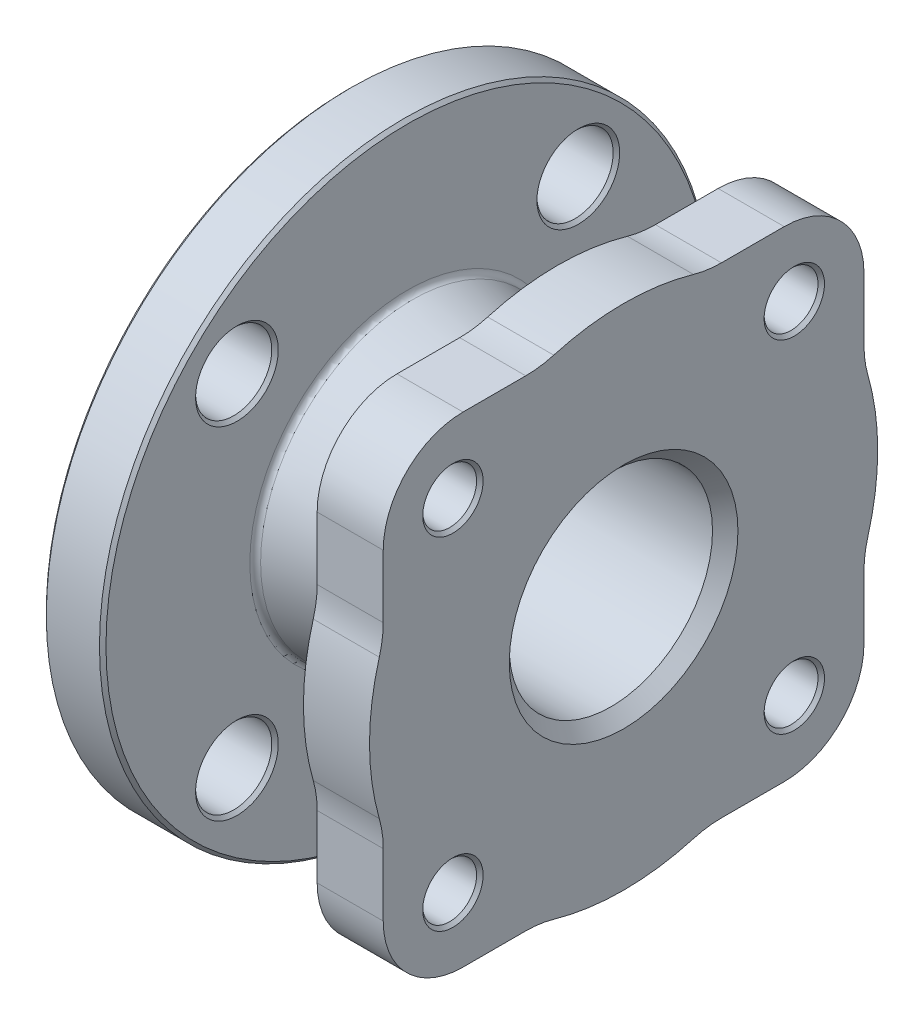
from build123d import *

# Parameters (mm, degrees)
SALIENTE_EXTRUIR1_START = 16.51
CROQUIS2_R              = 6.731
CROQUIS2_R_2            = 25.4
SALIENTE_EXTRUIR1_DEPTH = 16.51
CORTAR_EXTRUIR1_REACH   = 129.898
CROQUIS3_R              = 9.525
CHAFL_N1_SIZE           = 0.8128
CHAFL_N2_SIZE           = 3.175
REDONDEO1_R             = 1.524
CROQUIS4_R              = 25.4
CROQUIS4_R_2            = 6.731
SALIENTE_EXTRUIR2_DEPTH = 16.51
CROQUIS6_R              = 76.2
CROQUIS6_R_2            = 9.525
CROQUIS6_R_3            = 25.4
SALIENTE_EXTRUIR3_DEPTH = 16.51


with BuildPart() as part:
    # Croquis1 → Revolución1 (revolve)
    with BuildSketch(Plane.XY, mode=Mode.PRIVATE) as revoluci_n1_sk:
        Polygon((0, 25.4), (53.975, 25.4), (53.975, 47.625), (52.3748, 46.0248), (52.3748, 34.29), (34.925, 34.29), (16.51, 38.204229083), (16.51, 76.2), (1.6002, 76.2), (1.6002, 47.6377), (0, 46.0375), align=None)
    revolve(revoluci_n1_sk.sketch.rotate(Axis((0, 0, 0), (1, 0, 0)), 90), axis=Axis((0, 0, 0), (1, 0, 0)))

    # Croquis2 → Saliente-Extruir1 (add)
    with BuildSketch(Plane(origin=(53.975, 0, 0), x_dir=(0, 0, -1), z_dir=(1, 0, 0)).offset(SALIENTE_EXTRUIR1_START)):
        with BuildLine():
            Line((-60.071, 40.132), (-60.071, 24.4523651))
            ThreePointArc((-60.071, 24.4523651), (-60.317121003, 20.92499052), (-61.050714286, 17.465975072))
            ThreePointArc((-61.050714286, 17.465975072), (-63.5, 0), (-61.050714286, -17.465975072))
            ThreePointArc((-61.050714286, -17.465975072), (-60.317121003, -20.92499052), (-60.071, -24.4523651))
            Line((-60.071, -24.4523651), (-60.071, -40.132))
            ThreePointArc((-60.071, -40.132), (-54.23100211, -54.23100211), (-40.132, -60.071))
            Line((-40.132, -60.071), (-24.4523651, -60.071))
            ThreePointArc((-24.4523651, -60.071), (-20.92499052, -60.317121003), (-17.465975072, -61.050714286))
            ThreePointArc((-17.465975072, -61.050714286), (0, -63.5), (17.465975072, -61.050714286))
            ThreePointArc((17.465975072, -61.050714286), (20.92499052, -60.317121003), (24.4523651, -60.071))
            Line((24.4523651, -60.071), (40.132, -60.071))
            ThreePointArc((40.132, -60.071), (54.23100211, -54.23100211), (60.071, -40.132))
            Line((60.071, -40.132), (60.071, -24.4523651))
            ThreePointArc((60.071, -24.4523651), (60.317121003, -20.92499052), (61.050714286, -17.465975072))
            ThreePointArc((61.050714286, -17.465975072), (63.5, 0), (61.050714286, 17.465975072))
            ThreePointArc((61.050714286, 17.465975072), (60.317121003, 20.92499052), (60.071, 24.4523651))
            Line((60.071, 24.4523651), (60.071, 40.132))
            ThreePointArc((60.071, 40.132), (54.23100211, 54.23100211), (40.132, 60.071))
            Line((40.132, 60.071), (24.4523651, 60.071))
            ThreePointArc((24.4523651, 60.071), (20.92499052, 60.317121003), (17.465975072, 61.050714286))
            ThreePointArc((17.465975072, 61.050714286), (0, 63.5), (-17.465975072, 61.050714286))
            ThreePointArc((-17.465975072, 61.050714286), (-20.92499052, 60.317121003), (-24.4523651, 60.071))
            Line((-24.4523651, 60.071), (-40.132, 60.071))
            ThreePointArc((-40.132, 60.071), (-54.23100211, 54.23100211), (-60.071, 40.132))
        make_face()
        with Locations((-42.656216575, 42.656216575)):
            Circle(CROQUIS2_R, mode=Mode.SUBTRACT)
        with Locations((42.656216575, 42.656216575)):
            Circle(CROQUIS2_R, mode=Mode.SUBTRACT)
        with Locations((42.656216575, -42.656216575)):
            Circle(CROQUIS2_R, mode=Mode.SUBTRACT)
        with Locations((-42.656216575, -42.656216575)):
            Circle(CROQUIS2_R, mode=Mode.SUBTRACT)
        with Locations(Location((0, 0, 0), (0, 0, 180))):
            Circle(CROQUIS2_R_2, mode=Mode.SUBTRACT)
    extrude(amount=-SALIENTE_EXTRUIR1_DEPTH)

    # Croquis3 → Cortar-Extruir1 (cut, up to next)
    with BuildSketch(Plane.ZY.offset(-1.6002), mode=Mode.PRIVATE) as cortar_extruir1_sk1:
        with Locations((-42.656216575, 42.656216575)):
            Circle(CROQUIS3_R)
    cortar_extruir1_tool1 = extrude(cortar_extruir1_sk1.sketch, amount=-CORTAR_EXTRUIR1_REACH, mode=Mode.PRIVATE) & part.part
    # Croquis3 → Cortar-Extruir1 (cut, up to next)
    with BuildSketch(Plane.ZY.offset(-1.6002), mode=Mode.PRIVATE) as cortar_extruir1_sk2:
        with Locations((42.656216575, 42.656216575)):
            Circle(CROQUIS3_R)
    cortar_extruir1_tool2 = extrude(cortar_extruir1_sk2.sketch, amount=-CORTAR_EXTRUIR1_REACH, mode=Mode.PRIVATE) & part.part
    # Croquis3 → Cortar-Extruir1 (cut, up to next)
    with BuildSketch(Plane.ZY.offset(-1.6002), mode=Mode.PRIVATE) as cortar_extruir1_sk3:
        with Locations((42.656216575, -42.656216575)):
            Circle(CROQUIS3_R)
    cortar_extruir1_tool3 = extrude(cortar_extruir1_sk3.sketch, amount=-CORTAR_EXTRUIR1_REACH, mode=Mode.PRIVATE) & part.part
    # Croquis3 → Cortar-Extruir1 (cut, up to next)
    with BuildSketch(Plane.ZY.offset(-1.6002), mode=Mode.PRIVATE) as cortar_extruir1_sk4:
        with Locations((-42.656216575, -42.656216575)):
            Circle(CROQUIS3_R)
    cortar_extruir1_tool4 = extrude(cortar_extruir1_sk4.sketch, amount=-CORTAR_EXTRUIR1_REACH, mode=Mode.PRIVATE) & part.part
    add(cortar_extruir1_tool1.solids().sort_by_distance((1.6002, 42.656217, -42.656217))[0], mode=Mode.SUBTRACT)
    add(cortar_extruir1_tool2.solids().sort_by_distance((1.6002, 42.656217, 42.656217))[0], mode=Mode.SUBTRACT)
    add(cortar_extruir1_tool3.solids().sort_by_distance((1.6002, -42.656217, 42.656217))[0], mode=Mode.SUBTRACT)
    add(cortar_extruir1_tool4.solids().sort_by_distance((1.6002, -42.656217, -42.656217))[0], mode=Mode.SUBTRACT)

    # Chaflán1
    chafl_n1_edges = [part.edges().sort_by_distance(p)[0] for p in [
        (53.975, 42.656216575, 49.387216575),
        (53.975, 42.656216575, -35.925216575),
        (53.975, -42.656216575, -35.925216575),
        (53.975, -42.656216575, 49.387216575),
        (70.485, 42.656216575, 49.387216575),
        (70.485, 42.656216575, -35.925216575),
        (70.485, -42.656216575, -35.925216575),
        (70.485, -42.656216575, 49.387216575),
        (1.6002, 0, -76.2),
        (16.51, 0, -76.2),
        (1.6002, -42.656216575, -52.181216575),
        (16.51, -42.656216575, -52.181216575),
        (1.6002, -42.656216575, 33.131216575),
        (16.51, -42.656216575, 33.131216575),
        (1.6002, 42.656216575, 33.131216575),
        (16.51, 42.656216575, 33.131216575),
        (1.6002, 42.656216575, -52.181216575),
        (16.51, 42.656216575, -52.181216575),
    ]]
    chamfer(chafl_n1_edges, length=CHAFL_N1_SIZE)

    # Chaflán2
    chafl_n2_edges = [part.edges().sort_by_distance(p)[0] for p in [
        (0, 0, -25.4),
        (70.485, 0, -25.4),
    ]]
    chamfer(chafl_n2_edges, length=CHAFL_N2_SIZE)

    # Redondeo1
    redondeo1_edges = [part.edges().sort_by_distance(p)[0] for p in [
        (52.3748, 0, -34.29),
        (16.51, 0, -38.204229083),
    ]]
    fillet(redondeo1_edges, radius=REDONDEO1_R)


with BuildPart() as body_2:
    # Croquis4 → Saliente-Extruir2 (new body)
    with BuildSketch(Plane(origin=(70.485, 0, 0), x_dir=(0, 0, -1), z_dir=(1, 0, 0))):
        with BuildLine():
            Line((-24.4523651, 60.071), (-40.132, 60.071))
            ThreePointArc((-40.132, 60.071), (-54.23100211, 54.23100211), (-60.071, 40.132))
            Line((-60.071, 40.132), (-60.071, 24.4523651))
            ThreePointArc((-60.071, 24.4523651), (-60.317121003, 20.92499052), (-61.050714286, 17.465975072))
            ThreePointArc((-61.050714286, 17.465975072), (-63.5, 0), (-61.050714286, -17.465975072))
            ThreePointArc((-61.050714286, -17.465975072), (-60.317121003, -20.92499052), (-60.071, -24.4523651))
            Line((-60.071, -24.4523651), (-60.071, -40.132))
            ThreePointArc((-60.071, -40.132), (-54.23100211, -54.23100211), (-40.132, -60.071))
            Line((-40.132, -60.071), (-24.4523651, -60.071))
            ThreePointArc((-24.4523651, -60.071), (-20.92499052, -60.317121003), (-17.465975072, -61.050714286))
            ThreePointArc((-17.465975072, -61.050714286), (0, -63.5), (17.465975072, -61.050714286))
            ThreePointArc((17.465975072, -61.050714286), (20.92499052, -60.317121003), (24.4523651, -60.071))
            Line((24.4523651, -60.071), (40.132, -60.071))
            ThreePointArc((40.132, -60.071), (54.23100211, -54.23100211), (60.071, -40.132))
            Line((60.071, -40.132), (60.071, -24.4523651))
            ThreePointArc((60.071, -24.4523651), (60.317121003, -20.92499052), (61.050714286, -17.465975072))
            ThreePointArc((61.050714286, -17.465975072), (63.5, 0), (61.050714286, 17.465975072))
            ThreePointArc((61.050714286, 17.465975072), (60.317121003, 20.92499052), (60.071, 24.4523651))
            Line((60.071, 24.4523651), (60.071, 40.132))
            ThreePointArc((60.071, 40.132), (54.23100211, 54.23100211), (40.132, 60.071))
            Line((40.132, 60.071), (24.4523651, 60.071))
            ThreePointArc((24.4523651, 60.071), (20.92499052, 60.317121003), (17.465975072, 61.050714286))
            ThreePointArc((17.465975072, 61.050714286), (0, 63.5), (-17.465975072, 61.050714286))
            ThreePointArc((-17.465975072, 61.050714286), (-20.92499052, 60.317121003), (-24.4523651, 60.071))
        make_face()
        Circle(CROQUIS4_R, mode=Mode.SUBTRACT)
        with Locations((42.656216575, -42.656216575)):
            Circle(CROQUIS4_R_2, mode=Mode.SUBTRACT)
        with Locations((-42.656216575, -42.656216575)):
            Circle(CROQUIS4_R_2, mode=Mode.SUBTRACT)
        with Locations((42.656216575, 42.656216575)):
            Circle(CROQUIS4_R_2, mode=Mode.SUBTRACT)
        with Locations((-42.656216575, 42.656216575)):
            Circle(CROQUIS4_R_2, mode=Mode.SUBTRACT)
    extrude(amount=SALIENTE_EXTRUIR2_DEPTH)


with BuildPart() as body_3:
    # Croquis5 → Revolución2 (revolve)
    with BuildSketch(Plane.XY, mode=Mode.PRIVATE) as revoluci_n2_sk:
        with BuildLine():
            Line((86.995, -25.4), (156.845, -25.4))
            Line((156.845, -25.4), (156.845, -38.1))
            Line((156.845, -38.1), (141.097, -38.1))
            Line((141.097, -38.1), (100.143007491, -49.07358922))
            ThreePointArc((100.143007491, -49.07358922), (93.625730565, -50.369956202), (86.995, -50.804557244))
            Line((86.995, -50.804557244), (86.995, -25.4))
        make_face()
    revolve(revoluci_n2_sk.sketch.rotate(Axis((0, 0, 0), (1, 0, 0)), 90), axis=Axis((0, 0, 0), (1, 0, 0)))


with BuildPart() as body_4:
    # Croquis6 → Saliente-Extruir3 (new body)
    with BuildSketch(Plane(origin=(156.845, 0, 0), x_dir=(0, 0, -1), z_dir=(1, 0, 0))):
        with Locations(Location((0, 0, 0), (0, 0, 180))):
            Circle(CROQUIS6_R)
        with Locations(Location((42.656216575, -42.656216575, 0), (0, 0, 180))):
            Circle(CROQUIS6_R_2, mode=Mode.SUBTRACT)
        with Locations(Location((-42.656216575, -42.656216575, 0), (0, 0, 180))):
            Circle(CROQUIS6_R_2, mode=Mode.SUBTRACT)
        with Locations(Location((42.656216575, 42.656216575, 0), (0, 0, 180))):
            Circle(CROQUIS6_R_2, mode=Mode.SUBTRACT)
        with Locations(Location((-42.656216575, 42.656216575, 0), (0, 0, 180))):
            Circle(CROQUIS6_R_2, mode=Mode.SUBTRACT)
        Circle(CROQUIS6_R_3, mode=Mode.SUBTRACT)
    extrude(amount=SALIENTE_EXTRUIR3_DEPTH)


solid = part.part
